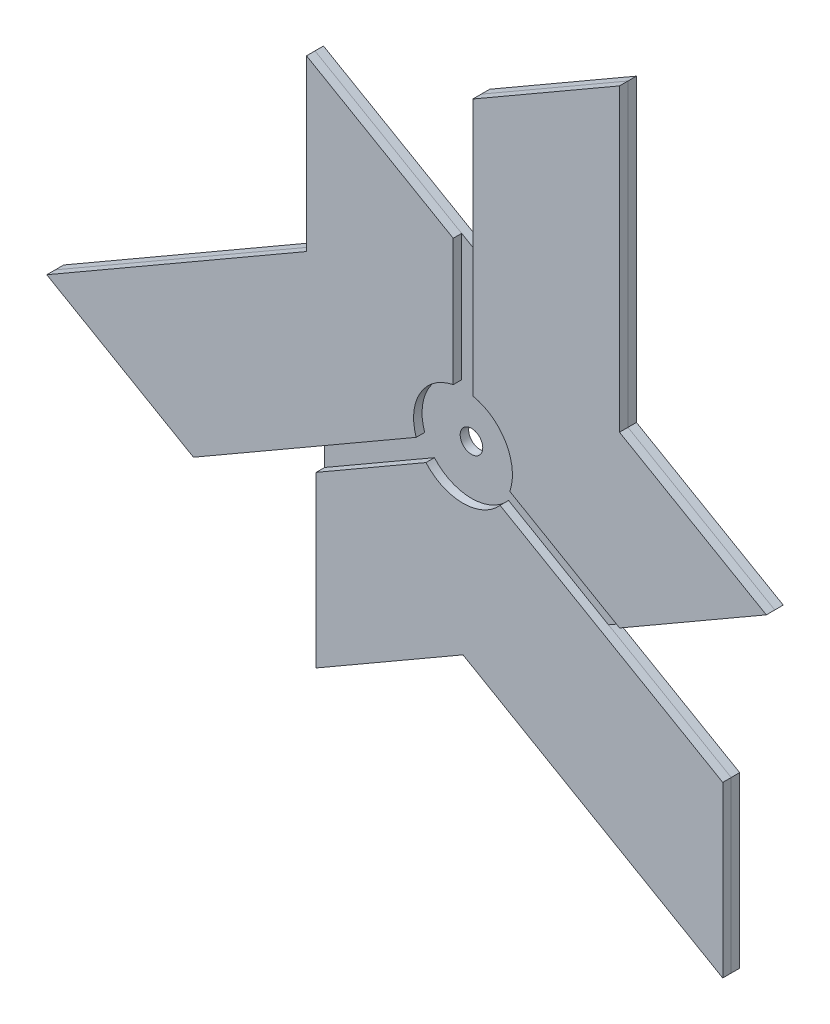
from build123d import *

# Parameters (mm, degrees)
BOSS_EXTRUDE1_DEPTH = 3
CIRPATTERN2_COUNT   = 3
BOSS_EXTRUDE2_START = -6
SKETCH6_R           = 4
BOSS_EXTRUDE2_DEPTH = 3


with BuildPart() as part:
    # Sketch1 → Boss-Extrude1 (new body)
    with BuildSketch(Plane.XY):
        with BuildLine():
            Line((-13.123503709, -11.576858399), (-52, -34.022213998))
            Line((-52, -34.022213998), (-52, -94.022213998))
            Line((-52, -94.022213998), (0, -64))
            Line((0, -64), (92, -117.116224765))
            Line((92, -117.116224765), (92, -57.116224765))
            Line((92, -57.116224765), (13.123503709, -11.576858399))
            ThreePointArc((13.123503709, -11.576858399), (0, -17.5), (-13.123503709, -11.576858399))
        make_face()
    extrude(amount=BOSS_EXTRUDE1_DEPTH)


with BuildPart() as cirpattern2_1:
    # CirPattern2: pattern copy
    add(part.part.rotate(Axis((0, 0, 0), (0, 0, 1)), 1 * 360 / CIRPATTERN2_COUNT))


with BuildPart() as cirpattern2_2:
    # CirPattern2: pattern copy
    add(part.part.rotate(Axis((0, 0, 0), (0, 0, 1)), 2 * 360 / CIRPATTERN2_COUNT))


with BuildPart() as body_4:
    # Sketch6 → Boss-Extrude2 (new body)
    with BuildSketch(Plane.XY.offset(3).offset(BOSS_EXTRUDE2_START)):
        Polygon((-55.425625842, 92.044427996), (-55.425625842, 32), (-147.425625842, -21.116224765), (-95.464101615, -51.116224765), (-52, -26.022213998), (-52, -94.022213998), (0, -64), (92, -117.116224765), (92, -57.116224765), (48.535898385, -32.022213998), (107.425625842, 1.977786002), (55.425625842, 32), (55.425625842, 138.232449531), (3.464101615, 108.232449531), (3.464101615, 58.044427996), align=None)
        Circle(SKETCH6_R, mode=Mode.SUBTRACT)
    extrude(amount=BOSS_EXTRUDE2_DEPTH)


solid = Compound([part.part, cirpattern2_1.part, cirpattern2_2.part, body_4.part])
